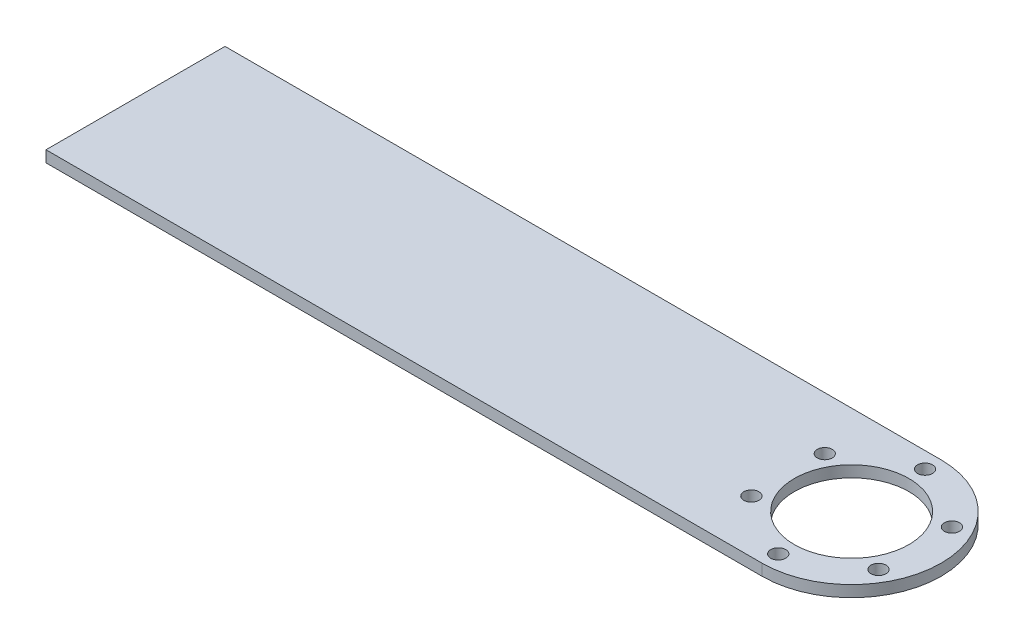
from build123d import *

# Parameters (mm, degrees)
BOSS_EXTRUDE1_DEPTH = 3.175
SKETCH2_R           = 16
SKETCH2_R_2         = 2.1
CUT_EXTRUDE1_DEPTH  = 128.515021174


with BuildPart() as part:
    # Sketch1 → Boss-Extrude1 (new body)
    with BuildSketch(Plane(origin=(0, 0, 0), x_dir=(1, 0, 0), z_dir=(0, 1, 0))):
        with BuildLine():
            Line((-100, -25), (100, -25))
            ThreePointArc((100, -25), (125, 0), (100, 25))
            Line((100, 25), (-100, 25))
            Line((-100, 25), (-100, -25))
        make_face()
    extrude(amount=BOSS_EXTRUDE1_DEPTH)

    # Sketch2 → Cut-Extrude1 (cut, through all)
    with BuildSketch(Plane(origin=(0, 3.175, 0), x_dir=(1, 0, 0), z_dir=(0, 1, 0))):
        with Locations(Location((100, 0, 0), (0, 0, 270))):
            Circle(SKETCH2_R)
        with Locations(Location((100, 20.5, 0), (0, 0, 270))):
            Circle(SKETCH2_R_2)
        with Locations(Location((117.753520778, 10.25, 0), (0, 0, 270))):
            Circle(SKETCH2_R_2)
        with Locations(Location((117.753520778, -10.25, 0), (0, 0, 270))):
            Circle(SKETCH2_R_2)
        with Locations(Location((100, -20.5, 0), (0, 0, 270))):
            Circle(SKETCH2_R_2)
        with Locations(Location((82.246479222, -10.25, 0), (0, 0, 270))):
            Circle(SKETCH2_R_2)
        with Locations(Location((82.246479222, 10.25, 0), (0, 0, 270))):
            Circle(SKETCH2_R_2)
    extrude(amount=-CUT_EXTRUDE1_DEPTH, mode=Mode.SUBTRACT)


solid = part.part
